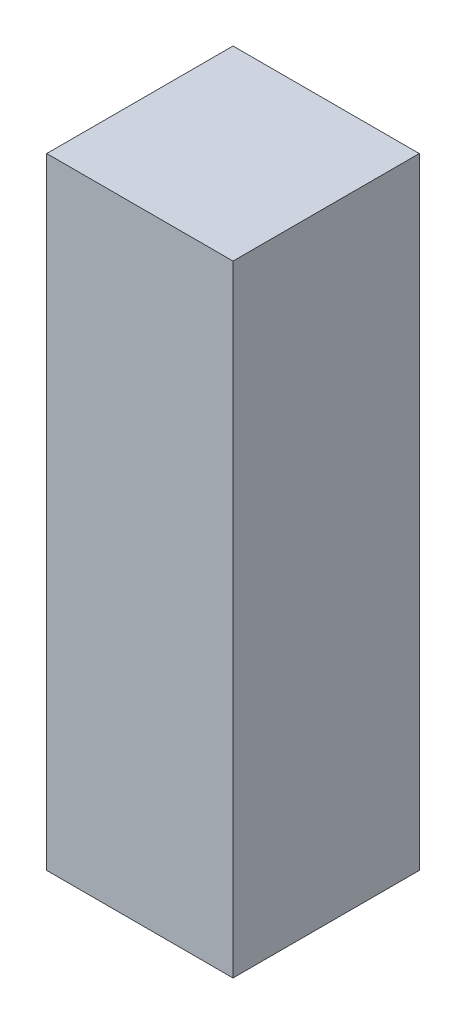
from build123d import *

# Parameters (mm, degrees)
SKETCH1_W           = 38.1
SKETCH1_H           = 38.1
BOSS_EXTRUDE1_DEPTH = 127


with BuildPart() as part:
    # Sketch1 → Boss-Extrude1 (new body)
    with BuildSketch(Plane(origin=(0, 0, 0), x_dir=(1, 0, 0), z_dir=(0, 1, 0))):
        Rectangle(SKETCH1_W, SKETCH1_H)
    extrude(amount=BOSS_EXTRUDE1_DEPTH)


solid = part.part
